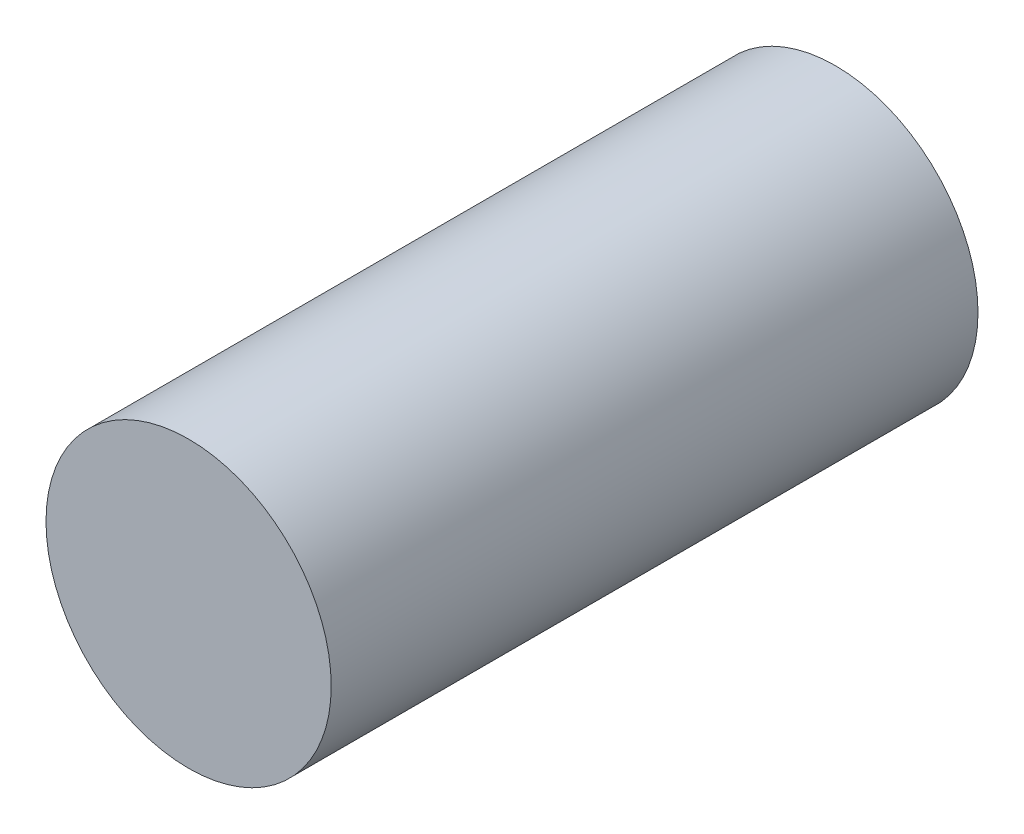
from build123d import *

# Parameters (mm, degrees)
SKETCH2_R           = 27.051
BOSS_EXTRUDE1_DEPTH = 122.682


with BuildPart() as part:
    # Sketch2 → Boss-Extrude1 (new body)
    with BuildSketch(Plane.XY):
        Circle(SKETCH2_R)
    extrude(amount=BOSS_EXTRUDE1_DEPTH)


solid = part.part
